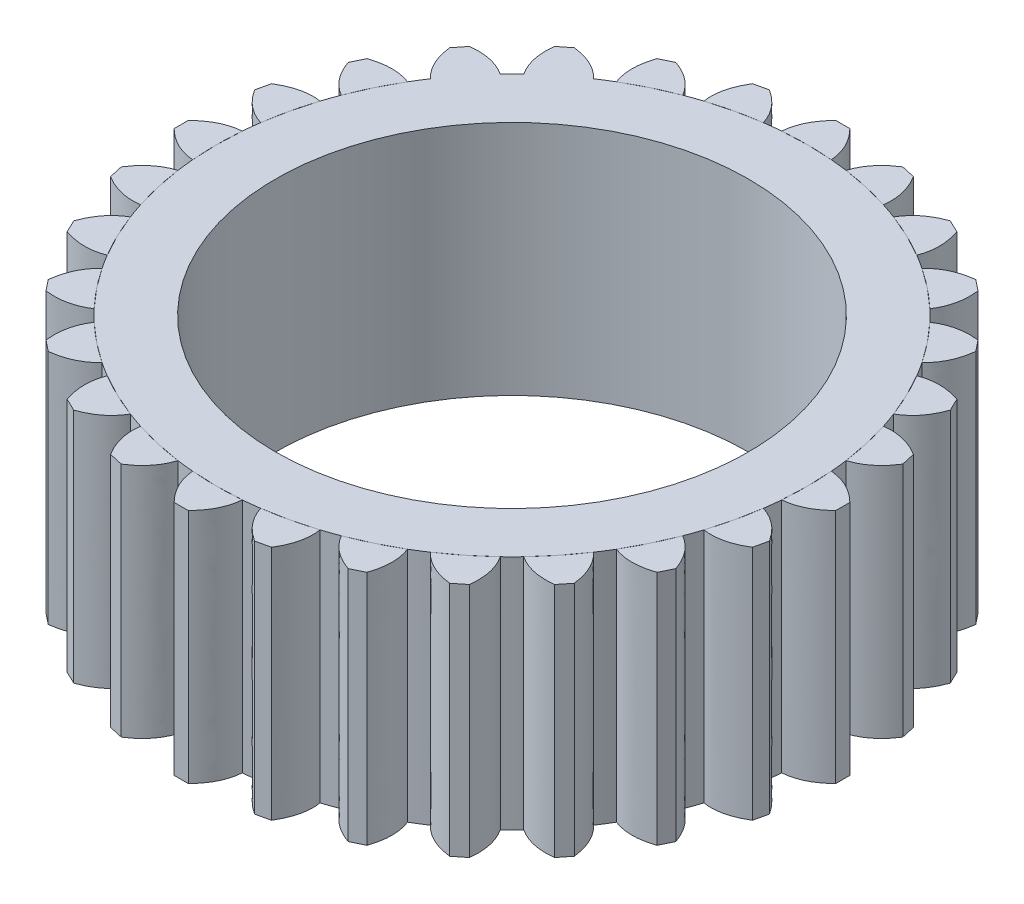
from build123d import *

# Parameters (mm, degrees)
BOSS_EXTRUDE1_DEPTH    = 1
BOSS_EXTRUDE1_2_DEPTH  = 1
BOSS_EXTRUDE1_3_DEPTH  = 1
BOSS_EXTRUDE1_4_DEPTH  = 1
BOSS_EXTRUDE1_5_DEPTH  = 1
BOSS_EXTRUDE1_6_DEPTH  = 1
BOSS_EXTRUDE1_7_DEPTH  = 1
BOSS_EXTRUDE1_8_DEPTH  = 1
BOSS_EXTRUDE1_9_DEPTH  = 1
BOSS_EXTRUDE1_10_DEPTH = 1
BOSS_EXTRUDE1_11_DEPTH = 1
BOSS_EXTRUDE1_12_DEPTH = 1
BOSS_EXTRUDE1_13_DEPTH = 1
BOSS_EXTRUDE1_14_DEPTH = 1
BOSS_EXTRUDE1_15_DEPTH = 1
BOSS_EXTRUDE1_16_DEPTH = 1
BOSS_EXTRUDE1_17_DEPTH = 1
BOSS_EXTRUDE1_18_DEPTH = 1
BOSS_EXTRUDE1_19_DEPTH = 1
BOSS_EXTRUDE1_20_DEPTH = 1
BOSS_EXTRUDE1_21_DEPTH = 1
BOSS_EXTRUDE1_22_DEPTH = 1
BOSS_EXTRUDE1_23_DEPTH = 1
BOSS_EXTRUDE1_24_DEPTH = 1
BOSS_EXTRUDE1_25_DEPTH = 1
BOSS_EXTRUDE1_26_DEPTH = 1
BOSS_EXTRUDE1_27_DEPTH = 1
SKETCH2_R              = 1
CUT_EXTRUDE1_DEPTH     = 1


with BuildPart() as part:
    # Sketch1 → Boss-Extrude1 (new body)
    with BuildSketch(Plane(origin=(0, 0, 0), x_dir=(1, 0, 0), z_dir=(0, 1, 0))):
        with BuildLine():
            Line((0.03, 1.398939794), (-0.03, 1.398939794))
            add(Edge.make_bspline(
                [(-0.03, 1.398939794), (-0.098532002, 1.329442722), (-0.105, 1.245582193)],
                knots=[0, 0, 0, 0.827520063, 0.827520063, 0.827520063], degree=2))
            ThreePointArc((-0.105, 1.245582193), (-0.052546449, 1.24889506), (0, 1.25))
            ThreePointArc((0, 1.25), (0.052546449, 1.24889506), (0.105, 1.245582193))
            add(Edge.make_bspline(
                [(0.03, 1.398939794), (0.098532002, 1.329442722), (0.105, 1.245582193)],
                knots=[0, 0, 0, 0.827520063, 0.827520063, 0.827520063], degree=2))
        make_face()
    extrude(amount=-BOSS_EXTRUDE1_DEPTH)


with BuildPart() as body_2:
    # Sketch1 → Boss-Extrude1 2 (new body)
    with BuildSketch(Plane(origin=(0, 0, 0), x_dir=(1, 0, 0), z_dir=(0, 1, 0))):
        with BuildLine():
            Line((-1.075030479, 0.89567964), (-1.112439867, 0.848769751))
            add(Edge.make_bspline(
                [(-1.112439867, 0.848769751), (-1.100833873, 0.751858558), (-1.039301802, 0.694515489)],
                knots=[0, 0, 0, 0.827520063, 0.827520063, 0.827520063], degree=2))
            ThreePointArc((-1.039301802, 0.694515489), (-1.058405249, 0.665040096), (-1.076672986, 0.63503959))
            Line((-1.076672986, 0.63503959), (-1.126211085, 0.542354674))
            Line((-1.126211085, 0.542354674), (-1.167788571, 0.445836128))
            ThreePointArc((-1.167788571, 0.445836128), (-1.179854163, 0.412848827), (-1.190988149, 0.379535544))
            Line((-1.190988149, 0.379535544), (-1.21865989, 0.278151167))
            Line((-1.21865989, 0.278151167), (-1.237717545, 0.174800682))
            ThreePointArc((-1.237717545, 0.174800682), (-1.242140262, 0.139955595), (-1.245582193, 0.105))
            Line((-1.245582193, 0.105), (-1.25, 0))
            Line((-1.25, 0), (-1.245582193, -0.105))
            ThreePointArc((-1.245582193, -0.105), (-1.242140262, -0.139955595), (-1.237717545, -0.174800682))
            Line((-1.237717545, -0.174800682), (-1.21865989, -0.278151167))
            Line((-1.21865989, -0.278151167), (-1.190988149, -0.379535544))
            ThreePointArc((-1.190988149, -0.379535544), (-1.179854163, -0.412848827), (-1.167788571, -0.445836128))
            Line((-1.167788571, -0.445836128), (-1.126211085, -0.542354674))
            Line((-1.126211085, -0.542354674), (-1.076672986, -0.63503959))
            ThreePointArc((-1.076672986, -0.63503959), (-1.058405249, -0.665040096), (-1.039301802, -0.694515489))
            Line((-1.039301802, -0.694515489), (-0.977289353, -0.779362252))
            Line((-0.977289353, -0.779362252), (-0.908368943, -0.8587001))
            ThreePointArc((-0.908368943, -0.8587001), (-0.883883476, -0.883883476), (-0.8587001, -0.908368943))
            Line((-0.8587001, -0.908368943), (-0.779362252, -0.977289353))
            Line((-0.779362252, -0.977289353), (-0.694515489, -1.039301802))
            ThreePointArc((-0.694515489, -1.039301802), (-0.665040096, -1.058405249), (-0.63503959, -1.076672986))
            Line((-0.63503959, -1.076672986), (-0.542354674, -1.126211085))
            Line((-0.542354674, -1.126211085), (-0.445836128, -1.167788571))
            ThreePointArc((-0.445836128, -1.167788571), (-0.412848827, -1.179854163), (-0.379535544, -1.190988149))
            Line((-0.379535544, -1.190988149), (-0.278151167, -1.21865989))
            Line((-0.278151167, -1.21865989), (-0.174800682, -1.237717545))
            ThreePointArc((-0.174800682, -1.237717545), (-0.139955595, -1.242140262), (-0.105, -1.245582193))
            Line((-0.105, -1.245582193), (0, -1.25))
            Line((0, -1.25), (0.105, -1.245582193))
            ThreePointArc((0.105, -1.245582193), (0.139955595, -1.242140262), (0.174800682, -1.237717545))
            Line((0.174800682, -1.237717545), (0.278151167, -1.21865989))
            Line((0.278151167, -1.21865989), (0.379535544, -1.190988149))
            ThreePointArc((0.379535544, -1.190988149), (0.412848827, -1.179854163), (0.445836128, -1.167788571))
            Line((0.445836128, -1.167788571), (0.542354674, -1.126211085))
            Line((0.542354674, -1.126211085), (0.63503959, -1.076672986))
            ThreePointArc((0.63503959, -1.076672986), (0.665040096, -1.058405249), (0.694515489, -1.039301802))
            Line((0.694515489, -1.039301802), (0.779362252, -0.977289353))
            Line((0.779362252, -0.977289353), (0.8587001, -0.908368943))
            ThreePointArc((0.8587001, -0.908368943), (0.883883476, -0.883883476), (0.908368943, -0.8587001))
            Line((0.908368943, -0.8587001), (0.977289353, -0.779362252))
            Line((0.977289353, -0.779362252), (1.039301802, -0.694515489))
            ThreePointArc((1.039301802, -0.694515489), (1.058405249, -0.665040096), (1.076672986, -0.63503959))
            Line((1.076672986, -0.63503959), (1.126211085, -0.542354674))
            Line((1.126211085, -0.542354674), (1.167788571, -0.445836128))
            ThreePointArc((1.167788571, -0.445836128), (1.179854163, -0.412848827), (1.190988149, -0.379535544))
            Line((1.190988149, -0.379535544), (1.21865989, -0.278151167))
            Line((1.21865989, -0.278151167), (1.237717545, -0.174800682))
            ThreePointArc((1.237717545, -0.174800682), (1.242140262, -0.139955595), (1.245582193, -0.105))
            Line((1.245582193, -0.105), (1.25, 0))
            Line((1.25, 0), (1.245582193, 0.105))
            ThreePointArc((1.245582193, 0.105), (1.242140262, 0.139955595), (1.237717545, 0.174800682))
            Line((1.237717545, 0.174800682), (1.21865989, 0.278151167))
            Line((1.21865989, 0.278151167), (1.190988149, 0.379535544))
            ThreePointArc((1.190988149, 0.379535544), (1.179854163, 0.412848827), (1.167788571, 0.445836128))
            Line((1.167788571, 0.445836128), (1.126211085, 0.542354674))
            Line((1.126211085, 0.542354674), (1.076672986, 0.63503959))
            ThreePointArc((1.076672986, 0.63503959), (1.058405249, 0.665040096), (1.039301802, 0.694515489))
            Line((1.039301802, 0.694515489), (0.977289353, 0.779362252))
            Line((0.977289353, 0.779362252), (0.908368943, 0.8587001))
            ThreePointArc((0.908368943, 0.8587001), (0.883883476, 0.883883476), (0.8587001, 0.908368943))
            Line((0.8587001, 0.908368943), (0.779362252, 0.977289353))
            Line((0.779362252, 0.977289353), (0.694515489, 1.039301802))
            ThreePointArc((0.694515489, 1.039301802), (0.665040096, 1.058405249), (0.63503959, 1.076672986))
            Line((0.63503959, 1.076672986), (0.542354674, 1.126211085))
            Line((0.542354674, 1.126211085), (0.445836128, 1.167788571))
            ThreePointArc((0.445836128, 1.167788571), (0.412848827, 1.179854163), (0.379535544, 1.190988149))
            Line((0.379535544, 1.190988149), (0.278151167, 1.21865989))
            Line((0.278151167, 1.21865989), (0.174800682, 1.237717545))
            ThreePointArc((0.174800682, 1.237717545), (0.139955595, 1.242140262), (0.105, 1.245582193))
            Line((0.105, 1.245582193), (0, 1.25))
            Line((0, 1.25), (-0.105, 1.245582193))
            ThreePointArc((-0.105, 1.245582193), (-0.139955595, 1.242140262), (-0.174800682, 1.237717545))
            Line((-0.174800682, 1.237717545), (-0.278151167, 1.21865989))
            Line((-0.278151167, 1.21865989), (-0.379535544, 1.190988149))
            ThreePointArc((-0.379535544, 1.190988149), (-0.412848827, 1.179854163), (-0.445836128, 1.167788571))
            Line((-0.445836128, 1.167788571), (-0.542354674, 1.126211085))
            Line((-0.542354674, 1.126211085), (-0.63503959, 1.076672986))
            ThreePointArc((-0.63503959, 1.076672986), (-0.665040096, 1.058405249), (-0.694515489, 1.039301802))
            add(Edge.make_bspline(
                [(-0.848769751, 1.112439867), (-0.751858558, 1.100833873), (-0.694515489, 1.039301802)],
                knots=[0, 0, 0, 0.827520063, 0.827520063, 0.827520063], degree=2))
            Line((-0.848769751, 1.112439867), (-0.89567964, 1.075030479))
            add(Edge.make_bspline(
                [(-0.89567964, 1.075030479), (-0.905929401, 0.977966476), (-0.8587001, 0.908368943)],
                knots=[0, 0, 0, 0.827520063, 0.827520063, 0.827520063], degree=2))
            ThreePointArc((-0.8587001, 0.908368943), (-0.883883476, 0.883883476), (-0.908368943, 0.8587001))
            add(Edge.make_bspline(
                [(-1.075030479, 0.89567964), (-0.977966476, 0.905929401), (-0.908368943, 0.8587001)],
                knots=[0, 0, 0, 0.827520063, 0.827520063, 0.827520063], degree=2))
        make_face()
    extrude(amount=-BOSS_EXTRUDE1_2_DEPTH)

    # Sketch2 → Cut-Extrude1 (cut)
    with BuildSketch(Plane(origin=(0, 0, 0), x_dir=(1, 0, 0), z_dir=(0, 1, 0))):
        with Locations(Location((0, 0, 0), (0, 0, 270))):
            Circle(SKETCH2_R)
    extrude(amount=-CUT_EXTRUDE1_DEPTH, mode=Mode.SUBTRACT)


with BuildPart() as body_3:
    # Sketch1 → Boss-Extrude1 3 (new body)
    with BuildSketch(Plane(origin=(0, 0, 0), x_dir=(1, 0, 0), z_dir=(0, 1, 0))):
        with BuildLine():
            ThreePointArc((-0.278151167, 1.21865989), (-0.226676296, 1.229275338), (-0.174800682, 1.237717545))
            add(Edge.make_bspline(
                [(-0.282045552, 1.370541081), (-0.199767237, 1.318036251), (-0.174800682, 1.237717545)],
                knots=[0, 0, 0, 0.827520063, 0.827520063, 0.827520063], degree=2))
            Line((-0.282045552, 1.370541081), (-0.340541227, 1.357189825))
            add(Edge.make_bspline(
                [(-0.340541227, 1.357189825), (-0.391890436, 1.274185384), (-0.379535544, 1.190988149)],
                knots=[0, 0, 0, 0.827520063, 0.827520063, 0.827520063], degree=2))
            ThreePointArc((-0.379535544, 1.190988149), (-0.329134295, 1.205889969), (-0.278151167, 1.21865989))
        make_face()
    extrude(amount=-BOSS_EXTRUDE1_3_DEPTH)


with BuildPart() as body_4:
    # Sketch1 → Boss-Extrude1 4 (new body)
    with BuildSketch(Plane(origin=(0, 0, 0), x_dir=(1, 0, 0), z_dir=(0, 1, 0))):
        with BuildLine():
            add(Edge.make_bspline(
                [(0.282045552, 1.370541081), (0.199767237, 1.318036251), (0.174800682, 1.237717545)],
                knots=[0, 0, 0, 0.827520063, 0.827520063, 0.827520063], degree=2))
            ThreePointArc((0.174800682, 1.237717545), (0.226676296, 1.229275338), (0.278151167, 1.21865989))
            ThreePointArc((0.278151167, 1.21865989), (0.329134295, 1.205889969), (0.379535544, 1.190988149))
            add(Edge.make_bspline(
                [(0.340541227, 1.357189825), (0.391890436, 1.274185384), (0.379535544, 1.190988149)],
                knots=[0, 0, 0, 0.827520063, 0.827520063, 0.827520063], degree=2))
            Line((0.340541227, 1.357189825), (0.282045552, 1.370541081))
        make_face()
    extrude(amount=-BOSS_EXTRUDE1_4_DEPTH)


with BuildPart() as body_5:
    # Sketch1 → Boss-Extrude1 5 (new body)
    with BuildSketch(Plane(origin=(0, 0, 0), x_dir=(1, 0, 0), z_dir=(0, 1, 0))):
        with BuildLine():
            ThreePointArc((-0.542354674, 1.126211085), (-0.494532544, 1.148014618), (-0.445836128, 1.167788571))
            add(Edge.make_bspline(
                [(-0.579948163, 1.273417715), (-0.488049313, 1.240537938), (-0.445836128, 1.167788571)],
                knots=[0, 0, 0, 0.827520063, 0.827520063, 0.827520063], degree=2))
            Line((-0.579948163, 1.273417715), (-0.634006295, 1.24738469))
            add(Edge.make_bspline(
                [(-0.634006295, 1.24738469), (-0.665597846, 1.155035071), (-0.63503959, 1.076672986)],
                knots=[0, 0, 0, 0.827520063, 0.827520063, 0.827520063], degree=2))
            ThreePointArc((-0.63503959, 1.076672986), (-0.589217973, 1.102416519), (-0.542354674, 1.126211085))
        make_face()
    extrude(amount=-BOSS_EXTRUDE1_5_DEPTH)


with BuildPart() as body_6:
    # Sketch1 → Boss-Extrude1 6 (new body)
    with BuildSketch(Plane(origin=(0, 0, 0), x_dir=(1, 0, 0), z_dir=(0, 1, 0))):
        with BuildLine():
            add(Edge.make_bspline(
                [(0.579948163, 1.273417715), (0.488049313, 1.240537938), (0.445836128, 1.167788571)],
                knots=[0, 0, 0, 0.827520063, 0.827520063, 0.827520063], degree=2))
            ThreePointArc((0.445836128, 1.167788571), (0.494532544, 1.148014618), (0.542354674, 1.126211085))
            ThreePointArc((0.542354674, 1.126211085), (0.589217973, 1.102416519), (0.63503959, 1.076672986))
            add(Edge.make_bspline(
                [(0.634006295, 1.24738469), (0.665597846, 1.155035071), (0.63503959, 1.076672986)],
                knots=[0, 0, 0, 0.827520063, 0.827520063, 0.827520063], degree=2))
            Line((0.634006295, 1.24738469), (0.579948163, 1.273417715))
        make_face()
    extrude(amount=-BOSS_EXTRUDE1_6_DEPTH)


with BuildPart() as body_7:
    # Sketch1 → Boss-Extrude1 7 (new body)
    with BuildSketch(Plane(origin=(0, 0, 0), x_dir=(1, 0, 0), z_dir=(0, 1, 0))):
        with BuildLine():
            add(Edge.make_bspline(
                [(0.848769751, 1.112439867), (0.751858558, 1.100833873), (0.694515489, 1.039301802)],
                knots=[0, 0, 0, 0.827520063, 0.827520063, 0.827520063], degree=2))
            ThreePointArc((0.694515489, 1.039301802), (0.737590866, 1.009187651), (0.779362252, 0.977289353))
            ThreePointArc((0.779362252, 0.977289353), (0.819755801, 0.943663301), (0.8587001, 0.908368943))
            add(Edge.make_bspline(
                [(0.89567964, 1.075030479), (0.905929401, 0.977966476), (0.8587001, 0.908368943)],
                knots=[0, 0, 0, 0.827520063, 0.827520063, 0.827520063], degree=2))
            Line((0.89567964, 1.075030479), (0.848769751, 1.112439867))
        make_face()
    extrude(amount=-BOSS_EXTRUDE1_7_DEPTH)


with BuildPart() as body_8:
    # Sketch1 → Boss-Extrude1 8 (new body)
    with BuildSketch(Plane(origin=(0, 0, 0), x_dir=(1, 0, 0), z_dir=(0, 1, 0))):
        with BuildLine():
            add(Edge.make_bspline(
                [(1.075030479, 0.89567964), (0.977966476, 0.905929401), (0.908368943, 0.8587001)],
                knots=[0, 0, 0, 0.827520063, 0.827520063, 0.827520063], degree=2))
            ThreePointArc((0.908368943, 0.8587001), (0.943663301, 0.819755801), (0.977289353, 0.779362252))
            ThreePointArc((0.977289353, 0.779362252), (1.009187651, 0.737590866), (1.039301802, 0.694515489))
            add(Edge.make_bspline(
                [(1.112439867, 0.848769751), (1.100833873, 0.751858558), (1.039301802, 0.694515489)],
                knots=[0, 0, 0, 0.827520063, 0.827520063, 0.827520063], degree=2))
            Line((1.112439867, 0.848769751), (1.075030479, 0.89567964))
        make_face()
    extrude(amount=-BOSS_EXTRUDE1_8_DEPTH)


with BuildPart() as body_9:
    # Sketch1 → Boss-Extrude1 9 (new body)
    with BuildSketch(Plane(origin=(0, 0, 0), x_dir=(1, 0, 0), z_dir=(0, 1, 0))):
        with BuildLine():
            ThreePointArc((-1.126211085, 0.542354674), (-1.102416519, 0.589217973), (-1.076672986, 0.63503959))
            add(Edge.make_bspline(
                [(-1.24738469, 0.634006295), (-1.155035071, 0.665597846), (-1.076672986, 0.63503959)],
                knots=[0, 0, 0, 0.827520063, 0.827520063, 0.827520063], degree=2))
            Line((-1.24738469, 0.634006295), (-1.273417715, 0.579948163))
            add(Edge.make_bspline(
                [(-1.273417715, 0.579948163), (-1.240537938, 0.488049313), (-1.167788571, 0.445836128)],
                knots=[0, 0, 0, 0.827520063, 0.827520063, 0.827520063], degree=2))
            ThreePointArc((-1.167788571, 0.445836128), (-1.148014618, 0.494532544), (-1.126211085, 0.542354674))
        make_face()
    extrude(amount=-BOSS_EXTRUDE1_9_DEPTH)


with BuildPart() as body_10:
    # Sketch1 → Boss-Extrude1 10 (new body)
    with BuildSketch(Plane(origin=(0, 0, 0), x_dir=(1, 0, 0), z_dir=(0, 1, 0))):
        with BuildLine():
            add(Edge.make_bspline(
                [(1.24738469, 0.634006295), (1.155035071, 0.665597846), (1.076672986, 0.63503959)],
                knots=[0, 0, 0, 0.827520063, 0.827520063, 0.827520063], degree=2))
            ThreePointArc((1.076672986, 0.63503959), (1.102416519, 0.589217973), (1.126211085, 0.542354674))
            ThreePointArc((1.126211085, 0.542354674), (1.148014618, 0.494532544), (1.167788571, 0.445836128))
            add(Edge.make_bspline(
                [(1.273417715, 0.579948163), (1.240537938, 0.488049313), (1.167788571, 0.445836128)],
                knots=[0, 0, 0, 0.827520063, 0.827520063, 0.827520063], degree=2))
            Line((1.273417715, 0.579948163), (1.24738469, 0.634006295))
        make_face()
    extrude(amount=-BOSS_EXTRUDE1_10_DEPTH)


with BuildPart() as body_11:
    # Sketch1 → Boss-Extrude1 11 (new body)
    with BuildSketch(Plane(origin=(0, 0, 0), x_dir=(1, 0, 0), z_dir=(0, 1, 0))):
        with BuildLine():
            ThreePointArc((-1.21865989, 0.278151167), (-1.205889969, 0.329134295), (-1.190988149, 0.379535544))
            add(Edge.make_bspline(
                [(-1.357189825, 0.340541227), (-1.274185384, 0.391890436), (-1.190988149, 0.379535544)],
                knots=[0, 0, 0, 0.827520063, 0.827520063, 0.827520063], degree=2))
            Line((-1.357189825, 0.340541227), (-1.370541081, 0.282045552))
            add(Edge.make_bspline(
                [(-1.370541081, 0.282045552), (-1.318036251, 0.199767237), (-1.237717545, 0.174800682)],
                knots=[0, 0, 0, 0.827520063, 0.827520063, 0.827520063], degree=2))
            ThreePointArc((-1.237717545, 0.174800682), (-1.229275338, 0.226676296), (-1.21865989, 0.278151167))
        make_face()
    extrude(amount=-BOSS_EXTRUDE1_11_DEPTH)


with BuildPart() as body_12:
    # Sketch1 → Boss-Extrude1 12 (new body)
    with BuildSketch(Plane(origin=(0, 0, 0), x_dir=(1, 0, 0), z_dir=(0, 1, 0))):
        with BuildLine():
            add(Edge.make_bspline(
                [(1.357189825, 0.340541227), (1.274185384, 0.391890436), (1.190988149, 0.379535544)],
                knots=[0, 0, 0, 0.827520063, 0.827520063, 0.827520063], degree=2))
            ThreePointArc((1.190988149, 0.379535544), (1.205889969, 0.329134295), (1.21865989, 0.278151167))
            ThreePointArc((1.21865989, 0.278151167), (1.229275338, 0.226676296), (1.237717545, 0.174800682))
            add(Edge.make_bspline(
                [(1.370541081, 0.282045552), (1.318036251, 0.199767237), (1.237717545, 0.174800682)],
                knots=[0, 0, 0, 0.827520063, 0.827520063, 0.827520063], degree=2))
            Line((1.370541081, 0.282045552), (1.357189825, 0.340541227))
        make_face()
    extrude(amount=-BOSS_EXTRUDE1_12_DEPTH)


with BuildPart() as body_13:
    # Sketch1 → Boss-Extrude1 13 (new body)
    with BuildSketch(Plane(origin=(0, 0, 0), x_dir=(1, 0, 0), z_dir=(0, 1, 0))):
        with BuildLine():
            ThreePointArc((-1.25, 0), (-1.24889506, 0.052546449), (-1.245582193, 0.105))
            add(Edge.make_bspline(
                [(-1.398939794, 0.03), (-1.329442722, 0.098532002), (-1.245582193, 0.105)],
                knots=[0, 0, 0, 0.827520063, 0.827520063, 0.827520063], degree=2))
            Line((-1.398939794, 0.03), (-1.398939794, -0.03))
            add(Edge.make_bspline(
                [(-1.398939794, -0.03), (-1.329442722, -0.098532002), (-1.245582193, -0.105)],
                knots=[0, 0, 0, 0.827520063, 0.827520063, 0.827520063], degree=2))
            ThreePointArc((-1.245582193, -0.105), (-1.24889506, -0.052546449), (-1.25, 0))
        make_face()
    extrude(amount=-BOSS_EXTRUDE1_13_DEPTH)


with BuildPart() as body_14:
    # Sketch1 → Boss-Extrude1 14 (new body)
    with BuildSketch(Plane(origin=(0, 0, 0), x_dir=(1, 0, 0), z_dir=(0, 1, 0))):
        with BuildLine():
            add(Edge.make_bspline(
                [(1.398939794, 0.03), (1.329442722, 0.098532002), (1.245582193, 0.105)],
                knots=[0, 0, 0, 0.827520063, 0.827520063, 0.827520063], degree=2))
            ThreePointArc((1.245582193, 0.105), (1.24889506, 0.052546449), (1.25, 0))
            ThreePointArc((1.25, 0), (1.24889506, -0.052546449), (1.245582193, -0.105))
            add(Edge.make_bspline(
                [(1.398939794, -0.03), (1.329442722, -0.098532002), (1.245582193, -0.105)],
                knots=[0, 0, 0, 0.827520063, 0.827520063, 0.827520063], degree=2))
            Line((1.398939794, -0.03), (1.398939794, 0.03))
        make_face()
    extrude(amount=-BOSS_EXTRUDE1_14_DEPTH)


with BuildPart() as body_15:
    # Sketch1 → Boss-Extrude1 15 (new body)
    with BuildSketch(Plane(origin=(0, 0, 0), x_dir=(1, 0, 0), z_dir=(0, 1, 0))):
        with BuildLine():
            ThreePointArc((-1.21865989, -0.278151167), (-1.229275338, -0.226676296), (-1.237717545, -0.174800682))
            add(Edge.make_bspline(
                [(-1.370541081, -0.282045552), (-1.318036251, -0.199767237), (-1.237717545, -0.174800682)],
                knots=[0, 0, 0, 0.827520063, 0.827520063, 0.827520063], degree=2))
            Line((-1.370541081, -0.282045552), (-1.357189825, -0.340541227))
            add(Edge.make_bspline(
                [(-1.357189825, -0.340541227), (-1.274185384, -0.391890436), (-1.190988149, -0.379535544)],
                knots=[0, 0, 0, 0.827520063, 0.827520063, 0.827520063], degree=2))
            ThreePointArc((-1.190988149, -0.379535544), (-1.205889969, -0.329134295), (-1.21865989, -0.278151167))
        make_face()
    extrude(amount=-BOSS_EXTRUDE1_15_DEPTH)


with BuildPart() as body_16:
    # Sketch1 → Boss-Extrude1 16 (new body)
    with BuildSketch(Plane(origin=(0, 0, 0), x_dir=(1, 0, 0), z_dir=(0, 1, 0))):
        with BuildLine():
            add(Edge.make_bspline(
                [(1.370541081, -0.282045552), (1.318036251, -0.199767237), (1.237717545, -0.174800682)],
                knots=[0, 0, 0, 0.827520063, 0.827520063, 0.827520063], degree=2))
            ThreePointArc((1.237717545, -0.174800682), (1.229275338, -0.226676296), (1.21865989, -0.278151167))
            ThreePointArc((1.21865989, -0.278151167), (1.205889969, -0.329134295), (1.190988149, -0.379535544))
            add(Edge.make_bspline(
                [(1.357189825, -0.340541227), (1.274185384, -0.391890436), (1.190988149, -0.379535544)],
                knots=[0, 0, 0, 0.827520063, 0.827520063, 0.827520063], degree=2))
            Line((1.357189825, -0.340541227), (1.370541081, -0.282045552))
        make_face()
    extrude(amount=-BOSS_EXTRUDE1_16_DEPTH)


with BuildPart() as body_17:
    # Sketch1 → Boss-Extrude1 17 (new body)
    with BuildSketch(Plane(origin=(0, 0, 0), x_dir=(1, 0, 0), z_dir=(0, 1, 0))):
        with BuildLine():
            ThreePointArc((-1.126211085, -0.542354674), (-1.148014618, -0.494532544), (-1.167788571, -0.445836128))
            add(Edge.make_bspline(
                [(-1.273417715, -0.579948163), (-1.240537938, -0.488049313), (-1.167788571, -0.445836128)],
                knots=[0, 0, 0, 0.827520063, 0.827520063, 0.827520063], degree=2))
            Line((-1.273417715, -0.579948163), (-1.24738469, -0.634006295))
            add(Edge.make_bspline(
                [(-1.24738469, -0.634006295), (-1.155035071, -0.665597846), (-1.076672986, -0.63503959)],
                knots=[0, 0, 0, 0.827520063, 0.827520063, 0.827520063], degree=2))
            ThreePointArc((-1.076672986, -0.63503959), (-1.102416519, -0.589217973), (-1.126211085, -0.542354674))
        make_face()
    extrude(amount=-BOSS_EXTRUDE1_17_DEPTH)


with BuildPart() as body_18:
    # Sketch1 → Boss-Extrude1 18 (new body)
    with BuildSketch(Plane(origin=(0, 0, 0), x_dir=(1, 0, 0), z_dir=(0, 1, 0))):
        with BuildLine():
            add(Edge.make_bspline(
                [(1.273417715, -0.579948163), (1.240537938, -0.488049313), (1.167788571, -0.445836128)],
                knots=[0, 0, 0, 0.827520063, 0.827520063, 0.827520063], degree=2))
            ThreePointArc((1.167788571, -0.445836128), (1.148014618, -0.494532544), (1.126211085, -0.542354674))
            ThreePointArc((1.126211085, -0.542354674), (1.102416519, -0.589217973), (1.076672986, -0.63503959))
            add(Edge.make_bspline(
                [(1.24738469, -0.634006295), (1.155035071, -0.665597846), (1.076672986, -0.63503959)],
                knots=[0, 0, 0, 0.827520063, 0.827520063, 0.827520063], degree=2))
            Line((1.24738469, -0.634006295), (1.273417715, -0.579948163))
        make_face()
    extrude(amount=-BOSS_EXTRUDE1_18_DEPTH)


with BuildPart() as body_19:
    # Sketch1 → Boss-Extrude1 19 (new body)
    with BuildSketch(Plane(origin=(0, 0, 0), x_dir=(1, 0, 0), z_dir=(0, 1, 0))):
        with BuildLine():
            ThreePointArc((-0.977289353, -0.779362252), (-1.009187651, -0.737590866), (-1.039301802, -0.694515489))
            add(Edge.make_bspline(
                [(-1.112439867, -0.848769751), (-1.100833873, -0.751858558), (-1.039301802, -0.694515489)],
                knots=[0, 0, 0, 0.827520063, 0.827520063, 0.827520063], degree=2))
            Line((-1.112439867, -0.848769751), (-1.075030479, -0.89567964))
            add(Edge.make_bspline(
                [(-1.075030479, -0.89567964), (-0.977966476, -0.905929401), (-0.908368943, -0.8587001)],
                knots=[0, 0, 0, 0.827520063, 0.827520063, 0.827520063], degree=2))
            ThreePointArc((-0.908368943, -0.8587001), (-0.943663301, -0.819755801), (-0.977289353, -0.779362252))
        make_face()
    extrude(amount=-BOSS_EXTRUDE1_19_DEPTH)


with BuildPart() as body_20:
    # Sketch1 → Boss-Extrude1 20 (new body)
    with BuildSketch(Plane(origin=(0, 0, 0), x_dir=(1, 0, 0), z_dir=(0, 1, 0))):
        with BuildLine():
            add(Edge.make_bspline(
                [(1.112439867, -0.848769751), (1.100833873, -0.751858558), (1.039301802, -0.694515489)],
                knots=[0, 0, 0, 0.827520063, 0.827520063, 0.827520063], degree=2))
            ThreePointArc((1.039301802, -0.694515489), (1.009187651, -0.737590866), (0.977289353, -0.779362252))
            ThreePointArc((0.977289353, -0.779362252), (0.943663301, -0.819755801), (0.908368943, -0.8587001))
            add(Edge.make_bspline(
                [(1.075030479, -0.89567964), (0.977966476, -0.905929401), (0.908368943, -0.8587001)],
                knots=[0, 0, 0, 0.827520063, 0.827520063, 0.827520063], degree=2))
            Line((1.075030479, -0.89567964), (1.112439867, -0.848769751))
        make_face()
    extrude(amount=-BOSS_EXTRUDE1_20_DEPTH)


with BuildPart() as body_21:
    # Sketch1 → Boss-Extrude1 21 (new body)
    with BuildSketch(Plane(origin=(0, 0, 0), x_dir=(1, 0, 0), z_dir=(0, 1, 0))):
        with BuildLine():
            ThreePointArc((-0.779362252, -0.977289353), (-0.819755801, -0.943663301), (-0.8587001, -0.908368943))
            add(Edge.make_bspline(
                [(-0.89567964, -1.075030479), (-0.905929401, -0.977966476), (-0.8587001, -0.908368943)],
                knots=[0, 0, 0, 0.827520063, 0.827520063, 0.827520063], degree=2))
            Line((-0.89567964, -1.075030479), (-0.848769751, -1.112439867))
            add(Edge.make_bspline(
                [(-0.848769751, -1.112439867), (-0.751858558, -1.100833873), (-0.694515489, -1.039301802)],
                knots=[0, 0, 0, 0.827520063, 0.827520063, 0.827520063], degree=2))
            ThreePointArc((-0.694515489, -1.039301802), (-0.737590866, -1.009187651), (-0.779362252, -0.977289353))
        make_face()
    extrude(amount=-BOSS_EXTRUDE1_21_DEPTH)


with BuildPart() as body_22:
    # Sketch1 → Boss-Extrude1 22 (new body)
    with BuildSketch(Plane(origin=(0, 0, 0), x_dir=(1, 0, 0), z_dir=(0, 1, 0))):
        with BuildLine():
            add(Edge.make_bspline(
                [(0.89567964, -1.075030479), (0.905929401, -0.977966476), (0.8587001, -0.908368943)],
                knots=[0, 0, 0, 0.827520063, 0.827520063, 0.827520063], degree=2))
            ThreePointArc((0.8587001, -0.908368943), (0.819755801, -0.943663301), (0.779362252, -0.977289353))
            ThreePointArc((0.779362252, -0.977289353), (0.737590866, -1.009187651), (0.694515489, -1.039301802))
            add(Edge.make_bspline(
                [(0.848769751, -1.112439867), (0.751858558, -1.100833873), (0.694515489, -1.039301802)],
                knots=[0, 0, 0, 0.827520063, 0.827520063, 0.827520063], degree=2))
            Line((0.848769751, -1.112439867), (0.89567964, -1.075030479))
        make_face()
    extrude(amount=-BOSS_EXTRUDE1_22_DEPTH)


with BuildPart() as body_23:
    # Sketch1 → Boss-Extrude1 23 (new body)
    with BuildSketch(Plane(origin=(0, 0, 0), x_dir=(1, 0, 0), z_dir=(0, 1, 0))):
        with BuildLine():
            ThreePointArc((-0.542354674, -1.126211085), (-0.589217973, -1.102416519), (-0.63503959, -1.076672986))
            add(Edge.make_bspline(
                [(-0.634006295, -1.24738469), (-0.665597846, -1.155035071), (-0.63503959, -1.076672986)],
                knots=[0, 0, 0, 0.827520063, 0.827520063, 0.827520063], degree=2))
            Line((-0.634006295, -1.24738469), (-0.579948163, -1.273417715))
            add(Edge.make_bspline(
                [(-0.579948163, -1.273417715), (-0.488049313, -1.240537938), (-0.445836128, -1.167788571)],
                knots=[0, 0, 0, 0.827520063, 0.827520063, 0.827520063], degree=2))
            ThreePointArc((-0.445836128, -1.167788571), (-0.494532544, -1.148014618), (-0.542354674, -1.126211085))
        make_face()
    extrude(amount=-BOSS_EXTRUDE1_23_DEPTH)


with BuildPart() as body_24:
    # Sketch1 → Boss-Extrude1 24 (new body)
    with BuildSketch(Plane(origin=(0, 0, 0), x_dir=(1, 0, 0), z_dir=(0, 1, 0))):
        with BuildLine():
            add(Edge.make_bspline(
                [(0.634006295, -1.24738469), (0.665597846, -1.155035071), (0.63503959, -1.076672986)],
                knots=[0, 0, 0, 0.827520063, 0.827520063, 0.827520063], degree=2))
            ThreePointArc((0.63503959, -1.076672986), (0.589217973, -1.102416519), (0.542354674, -1.126211085))
            ThreePointArc((0.542354674, -1.126211085), (0.494532544, -1.148014618), (0.445836128, -1.167788571))
            add(Edge.make_bspline(
                [(0.579948163, -1.273417715), (0.488049313, -1.240537938), (0.445836128, -1.167788571)],
                knots=[0, 0, 0, 0.827520063, 0.827520063, 0.827520063], degree=2))
            Line((0.579948163, -1.273417715), (0.634006295, -1.24738469))
        make_face()
    extrude(amount=-BOSS_EXTRUDE1_24_DEPTH)


with BuildPart() as body_25:
    # Sketch1 → Boss-Extrude1 25 (new body)
    with BuildSketch(Plane(origin=(0, 0, 0), x_dir=(1, 0, 0), z_dir=(0, 1, 0))):
        with BuildLine():
            ThreePointArc((-0.278151167, -1.21865989), (-0.329134295, -1.205889969), (-0.379535544, -1.190988149))
            add(Edge.make_bspline(
                [(-0.340541227, -1.357189825), (-0.391890436, -1.274185384), (-0.379535544, -1.190988149)],
                knots=[0, 0, 0, 0.827520063, 0.827520063, 0.827520063], degree=2))
            Line((-0.340541227, -1.357189825), (-0.282045552, -1.370541081))
            add(Edge.make_bspline(
                [(-0.282045552, -1.370541081), (-0.199767237, -1.318036251), (-0.174800682, -1.237717545)],
                knots=[0, 0, 0, 0.827520063, 0.827520063, 0.827520063], degree=2))
            ThreePointArc((-0.174800682, -1.237717545), (-0.226676296, -1.229275338), (-0.278151167, -1.21865989))
        make_face()
    extrude(amount=-BOSS_EXTRUDE1_25_DEPTH)


with BuildPart() as body_26:
    # Sketch1 → Boss-Extrude1 26 (new body)
    with BuildSketch(Plane(origin=(0, 0, 0), x_dir=(1, 0, 0), z_dir=(0, 1, 0))):
        with BuildLine():
            add(Edge.make_bspline(
                [(0.340541227, -1.357189825), (0.391890436, -1.274185384), (0.379535544, -1.190988149)],
                knots=[0, 0, 0, 0.827520063, 0.827520063, 0.827520063], degree=2))
            ThreePointArc((0.379535544, -1.190988149), (0.329134295, -1.205889969), (0.278151167, -1.21865989))
            ThreePointArc((0.278151167, -1.21865989), (0.226676296, -1.229275338), (0.174800682, -1.237717545))
            add(Edge.make_bspline(
                [(0.282045552, -1.370541081), (0.199767237, -1.318036251), (0.174800682, -1.237717545)],
                knots=[0, 0, 0, 0.827520063, 0.827520063, 0.827520063], degree=2))
            Line((0.282045552, -1.370541081), (0.340541227, -1.357189825))
        make_face()
    extrude(amount=-BOSS_EXTRUDE1_26_DEPTH)


with BuildPart() as body_27:
    # Sketch1 → Boss-Extrude1 27 (new body)
    with BuildSketch(Plane(origin=(0, 0, 0), x_dir=(1, 0, 0), z_dir=(0, 1, 0))):
        with BuildLine():
            ThreePointArc((0, -1.25), (-0.052546449, -1.24889506), (-0.105, -1.245582193))
            add(Edge.make_bspline(
                [(-0.03, -1.398939794), (-0.098532002, -1.329442722), (-0.105, -1.245582193)],
                knots=[0, 0, 0, 0.827520063, 0.827520063, 0.827520063], degree=2))
            Line((-0.03, -1.398939794), (0.03, -1.398939794))
            add(Edge.make_bspline(
                [(0.03, -1.398939794), (0.098532002, -1.329442722), (0.105, -1.245582193)],
                knots=[0, 0, 0, 0.827520063, 0.827520063, 0.827520063], degree=2))
            ThreePointArc((0.105, -1.245582193), (0.052546449, -1.24889506), (0, -1.25))
        make_face()
    extrude(amount=-BOSS_EXTRUDE1_27_DEPTH)


solid = Compound([part.part, body_2.part, body_3.part, body_4.part, body_5.part, body_6.part, body_7.part, body_8.part, body_9.part, body_10.part, body_11.part, body_12.part, body_13.part, body_14.part, body_15.part, body_16.part, body_17.part, body_18.part, body_19.part, body_20.part, body_21.part, body_22.part, body_23.part, body_24.part, body_25.part, body_26.part, body_27.part])
